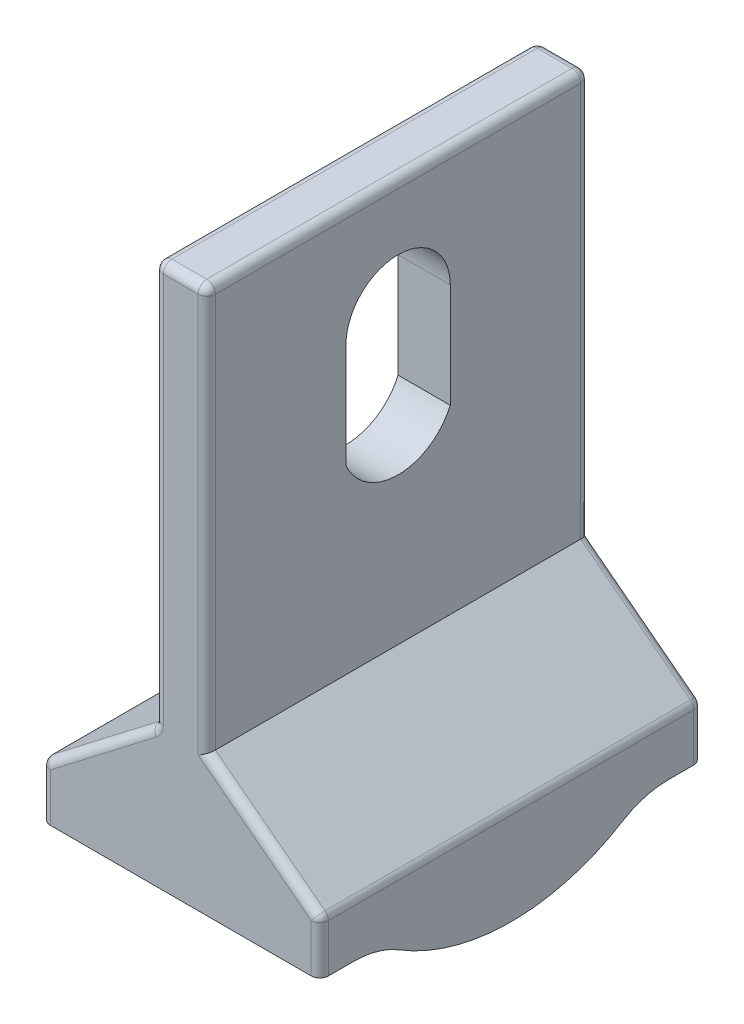
from build123d import *

# Parameters (mm, degrees)
RESSALTO_EXTRUS_O1_DEPTH = 22
RESSALTO_EXTRUS_O2_DEPTH = 16
FILETE1_R                = 5
FILETE2_R                = 0.5
FILETE3_R                = 0.5
CORTE_EXTRUS_O1_DEPTH    = 43.143081298


with BuildPart() as part:
    # Esboço2 → Ressalto-extrusão1 (new body)
    with BuildSketch(Plane.XY):
        Polygon((-1.5, 34.66683278), (1.5, 34.66683278), (1.5, 11.46683278), (8, 6.46683278), (8, 3.46683278), (-8, 3.46683278), (-8, 6.46683278), (-1.5, 11.46683278), align=None)
    extrude(amount=RESSALTO_EXTRUS_O1_DEPTH)

    # Esboço3 → Ressalto-extrusão2 (add)
    with BuildSketch(Plane(origin=(8, 0, 0), x_dir=(0, 0, -1), z_dir=(1, 0, 0))):
        with BuildLine():
            Line((-18.5, 3.46683278), (-3.5, 3.46683278))
            ThreePointArc((-3.5, 3.46683278), (-11, 0.913484582), (-18.5, 3.46683278))
        make_face()
    extrude(amount=-RESSALTO_EXTRUS_O2_DEPTH)

    # Filete1
    filete1_edges = [part.edges().sort_by_distance(p)[0] for p in [
        (0, 3.46683278, 3.5),
        (0, 3.46683278, 18.5),
    ]]
    fillet(filete1_edges, radius=FILETE1_R)

    # Filete2
    filete2_edges = [part.edges().sort_by_distance(p)[0] for p in [
        (0, 34.66683278, 22),
        (1.5, 23.06683278, 0),
        (4.75, 8.96683278, 0),
        (-1.5, 23.06683278, 22),
        (8, 6.46683278, 11),
        (-1.5, 11.46683278, 11),
        (-1.5, 34.66683278, 11),
        (1.5, 34.66683278, 11),
        (-4.75, 8.96683278, 22),
        (-8, 4.96683278, 22),
        (8, 4.96683278, 22),
        (4.75, 8.96683278, 22),
        (1.5, 23.06683278, 22),
        (8, 4.96683278, 0),
        (-8, 4.96683278, 0),
        (-4.75, 8.96683278, 0),
        (-1.5, 23.06683278, 0),
        (0, 34.66683278, 0),
    ]]
    fillet(filete2_edges, radius=FILETE2_R)

    # Filete3
    filete3_edges = [part.edges().sort_by_distance(p)[0] for p in [
        (-8, 6.46683278, 11),
        (-7.843873382, 6.389955799, 21.86297534),
        (-7.843873382, 6.389955799, 0.13702466),
    ]]
    fillet(filete3_edges, radius=FILETE3_R)

    # Esboço4 → Corte-extrusão1 (cut, through all)
    with BuildSketch(Plane(origin=(1.5, 0, 0), x_dir=(0, 0, -1), z_dir=(1, 0, 0))):
        with BuildLine():
            Line((-14, 27.885318181), (-14, 21.885318181))
            ThreePointArc((-14, 21.885318181), (-11, 19.91907546), (-8, 21.885318181))
            Line((-8, 21.885318181), (-8, 27.885318181))
            ThreePointArc((-8, 27.885318181), (-11, 30.885318181), (-14, 27.885318181))
        make_face()
    extrude(amount=-CORTE_EXTRUS_O1_DEPTH, mode=Mode.SUBTRACT)


solid = part.part
